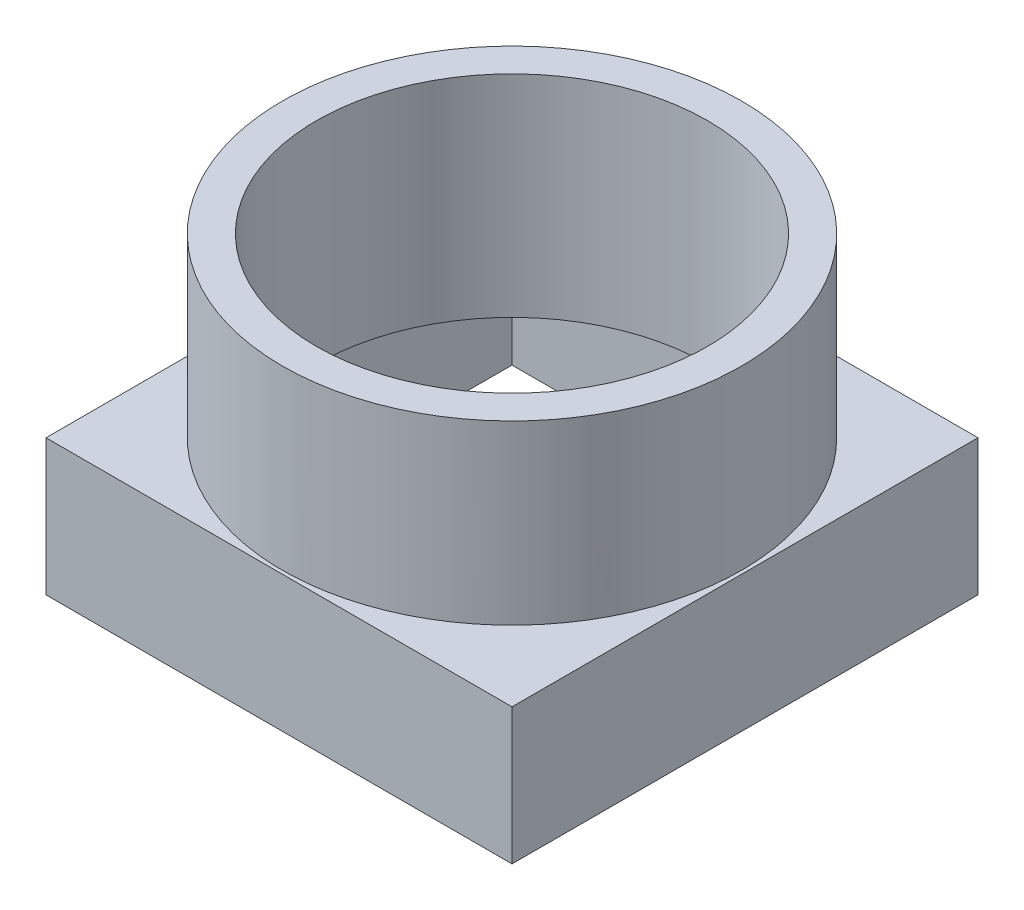
from build123d import *

# Parameters (mm, degrees)
SKETCH1_W           = 13.7
SKETCH1_H           = 13.7
BOSS_EXTRUDE1_DEPTH = 4
SKETCH2_R           = 6.75
BOSS_EXTRUDE2_DEPTH = 9.2
SHELL1_T            = -1


with BuildPart() as part:
    # Sketch1 → Boss-Extrude1 (new body)
    with BuildSketch(Plane(origin=(0, 0, 0), x_dir=(1, 0, 0), z_dir=(0, 1, 0))):
        Rectangle(SKETCH1_W, SKETCH1_H)
    extrude(amount=BOSS_EXTRUDE1_DEPTH)

    # Sketch2 → Boss-Extrude2 (add)
    with BuildSketch(Plane(origin=(0, 0, 0), x_dir=(1, 0, 0), z_dir=(0, 1, 0))):
        with Locations(Location((0, 0, 0), (0, 0, 90))):
            Circle(SKETCH2_R)
    extrude(amount=BOSS_EXTRUDE2_DEPTH)

    # Shell1
    shell1_openings = [part.faces().sort_by_distance(p)[0] for p in [
        (0, 9.2, 0),
        (0, 0, 0),
    ]]
    offset(amount=SHELL1_T, openings=shell1_openings, kind=Kind.INTERSECTION)


solid = part.part
